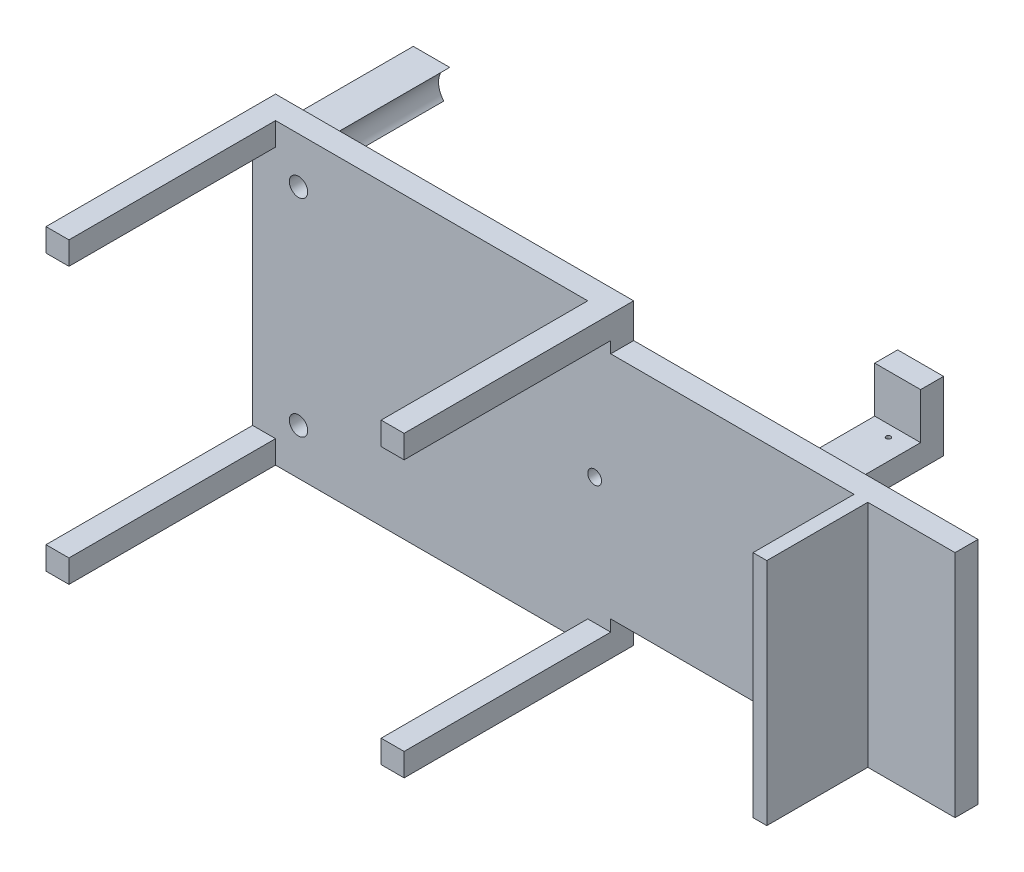
from build123d import *

# Parameters (mm, degrees)
CROQUIS1_R               = 2
CROQUIS1_R_2             = 1.5
CROQUIS1_W               = 75
CROQUIS1_H               = 50
SALIENTE_EXTRUIR4_DEPTH  = 5
CROQUIS3_W               = 5
CROQUIS3_H               = 5
SALIENTE_EXTRUIR5_DEPTH  = 50
CROQUIS4_W               = 3
CROQUIS4_H               = 50
SALIENTE_EXTRUIR7_DEPTH  = 22
SALIENTE_EXTRUIR9_DEPTH  = 27.5
CROQUIS7_W               = 10
CROQUIS7_H               = 5
SALIENTE_EXTRUIR10_DEPTH = 10
CROQUIS8_W               = 10
CROQUIS8_H               = 5
SALIENTE_EXTRUIR11_DEPTH = 10
SALIENTE_EXTRUIR12_DEPTH = 30
CROQUIS10_R              = 0.5
CORTAR_EXTRUIR2_DEPTH    = 43


with BuildPart() as part:
    # Croquis1 → Saliente-Extruir4 (new body)
    # profile 1 of 2: a face of its own
    with BuildSketch(Plane.XY):
        Polygon((-71.5, -27.5), (-71.5, -32.5), (-3.5, -32.5), (-3.5, -27.5), (1.5, -27.5), (1.5, -25), (1.5, 25), (1.5, 27.5), (-3.5, 27.5), (-3.5, 32.5), (-71.5, 32.5), (-71.5, 27.5), (-76.5, 27.5), (-76.5, -27.5), align=None)
        with Locations((-66.5, -22.5)):
            Circle(CROQUIS1_R, mode=Mode.SUBTRACT)
        with Locations((-2, 0)):
            Circle(CROQUIS1_R_2, mode=Mode.SUBTRACT)
        with Locations((-66.5, 22.5)):
            Circle(CROQUIS1_R, mode=Mode.SUBTRACT)
    # profile 2 of 2: a face of its own
    with BuildSketch(Plane.XY):
        with Locations((39, 0)):
            Rectangle(CROQUIS1_W, CROQUIS1_H)
    extrude(amount=SALIENTE_EXTRUIR4_DEPTH)

    # Croquis3 → Saliente-Extruir5 (add)
    with BuildSketch(Plane(origin=(0, 0, 0), x_dir=(-1, 0, 0), z_dir=(0, 0, -1))):
        with Locations((74, 30)):
            Rectangle(CROQUIS3_W, CROQUIS3_H)
        with Locations((1, -30)):
            Rectangle(CROQUIS3_W, CROQUIS3_H)
        with Locations((1, 30)):
            Rectangle(CROQUIS3_W, CROQUIS3_H)
        with Locations((74, -30)):
            Rectangle(CROQUIS3_W, CROQUIS3_H)
    extrude(amount=-SALIENTE_EXTRUIR5_DEPTH)

    # Croquis4 → Saliente-Extruir7 (add)
    with BuildSketch(Plane.XY.offset(5)):
        with Locations((56, 0)):
            Rectangle(CROQUIS4_W, CROQUIS4_H)
    extrude(amount=SALIENTE_EXTRUIR7_DEPTH)

    # Croquis6 → Saliente-Extruir9 (add)
    with BuildSketch(Plane(origin=(0, 0, 0), x_dir=(-1, 0, 0), z_dir=(0, 0, -1))):
        Polygon((-31.5, 13.5), (-31.5, 14.5), (-41.5, 14.5), (-41.5, 13.5), (-41.5, 9.5), (-31.5, 9.5), align=None)
        Polygon((-31.5, -13.5), (-31.5, -9.5), (-41.5, -9.5), (-41.5, -13.5), (-41.5, -14.5), (-31.5, -14.5), align=None)
    extrude(amount=SALIENTE_EXTRUIR9_DEPTH)

    # Croquis7 → Saliente-Extruir10 (add)
    with BuildSketch(Plane(origin=(0, 14.5, 0), x_dir=(1, 0, 0), z_dir=(0, 1, 0))):
        with Locations((36.5, 25)):
            Rectangle(CROQUIS7_W, CROQUIS7_H)
    extrude(amount=SALIENTE_EXTRUIR10_DEPTH)

    # Croquis8 → Saliente-Extruir11 (add)
    with BuildSketch(Plane.XZ.offset(14.5)):
        with Locations((36.5, -25)):
            Rectangle(CROQUIS8_W, CROQUIS8_H)
    extrude(amount=SALIENTE_EXTRUIR11_DEPTH)

    # Croquis9 → Saliente-Extruir12 (add)
    with BuildSketch(Plane(origin=(0, 0, 0), x_dir=(-1, 0, 0), z_dir=(0, 0, -1))):
        with BuildLine():
            Line((69.854101966, -19.5), (76.5, -19.5))
            Line((76.5, -19.5), (76.5, -26.5))
            Line((76.5, -26.5), (68.561552813, -26.5))
            ThreePointArc((68.561552813, -26.5), (70.925192558, -23.317111271), (69.854101966, -19.5))
        make_face()
        with BuildLine():
            Line((68.561552813, 26.5), (76.5, 26.5))
            Line((76.5, 26.5), (76.5, 19.5))
            Line((76.5, 19.5), (69.854101966, 19.5))
            ThreePointArc((69.854101966, 19.5), (70.925192558, 23.317111271), (68.561552813, 26.5))
        make_face()
    extrude(amount=SALIENTE_EXTRUIR12_DEPTH)

    # Croquis10 → Cortar-Extruir2 (cut)
    with BuildSketch(Plane.XZ.offset(14.5)):
        with Locations(Location((37, -4, 0), (0, 0, 270))):
            Circle(CROQUIS10_R)
        with Locations(Location((37, -20, 0), (0, 0, 270))):
            Circle(CROQUIS10_R)
    extrude(amount=-CORTAR_EXTRUIR2_DEPTH, mode=Mode.SUBTRACT)


solid = part.part
